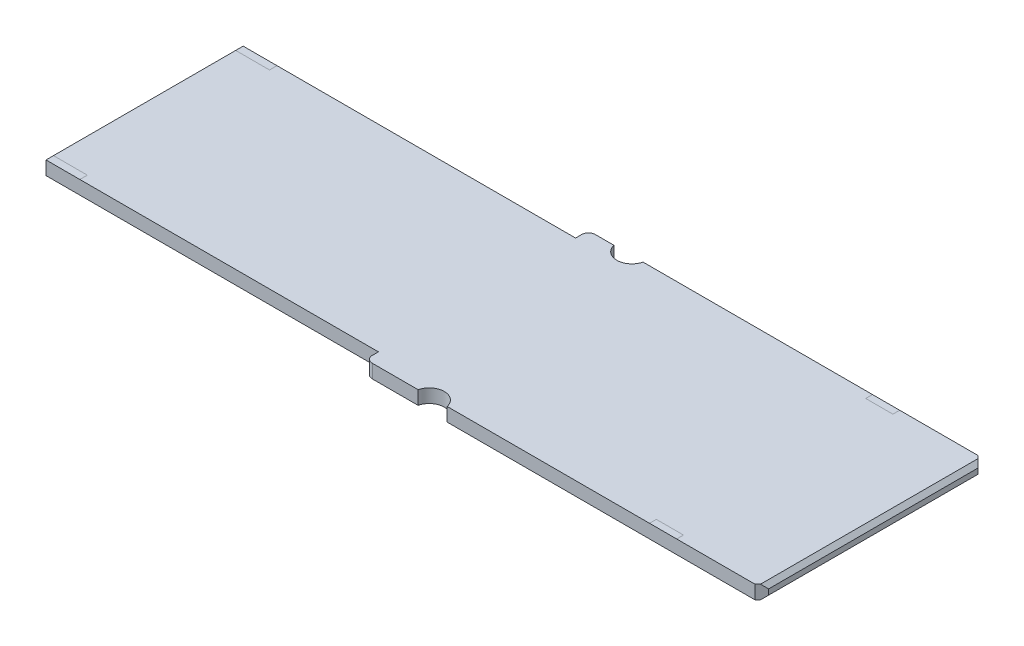
from build123d import *

# Parameters (mm, degrees)
BOSS_EXTRUDE1_DEPTH = 0.5
CHAMFER3_SIZE       = 0.5
SKETCH2_R           = 1.1
CUT_EXTRUDE1_DEPTH  = 55.232831385
FILLET1_R           = 0.5
SKETCH8_W           = 2.49
SKETCH8_H           = 0.55
SKETCH8_W_2         = 2
SKETCH8_H_2         = 0.5
CUT_EXTRUDE3_DEPTH  = 0.0001
SKETCH9_W           = 2
SKETCH9_H           = 16.4
CUT_EXTRUDE4_DEPTH  = 0.0001
CHAMFER4_SIZE       = 0.3


with BuildPart() as part:
    # Sketch1 → Boss-Extrude1 (new, symmetric)
    with BuildSketch(Plane(origin=(0, 0, 0), x_dir=(1, 0, 0), z_dir=(0, 1, 0))):
        Polygon((0, 7.25), (0, -7.25), (24.45, -7.25), (24.45, -8.2), (53.6, -8.2), (53.6, 8.2), (24.45, 8.2), (24.45, 7.25), align=None)
    extrude(amount=BOSS_EXTRUDE1_DEPTH, both=True)

    # Chamfer3
    chamfer3_edges = [part.edges().sort_by_distance(p)[0] for p in [
        (53.6, 0, -8.2),
        (53.6, 0, 8.2),
    ]]
    chamfer(chamfer3_edges, length=CHAMFER3_SIZE)

    # Sketch2 → Cut-Extrude1 (cut, through all)
    with BuildSketch(Plane.XZ.offset(0.5)):
        with Locations((29.39, 8.45)):
            Circle(SKETCH2_R)
        with Locations((27.39, -8.45)):
            Circle(SKETCH2_R)
    extrude(amount=-CUT_EXTRUDE1_DEPTH, mode=Mode.SUBTRACT)

    # Fillet1
    fillet1_edges = [part.edges().sort_by_distance(p)[0] for p in [
        (24.45, 0, -8.2),
        (24.45, 0, 8.2),
    ]]
    fillet(fillet1_edges, radius=FILLET1_R)

    # Sketch8 → Cut-Extrude3 (cut)
    with BuildSketch(Plane(origin=(0, 0.5, 0), x_dir=(1, 0, 0), z_dir=(0, 1, 0))):
        with Locations((1.245, -6.975)):
            Rectangle(SKETCH8_W, SKETCH8_H)
        with Locations((1.245, 6.975)):
            Rectangle(SKETCH8_W, SKETCH8_H)
        with Locations((46.34, -7.95)):
            Rectangle(SKETCH8_W_2, SKETCH8_H_2)
        with Locations((46.34, 7.95)):
            Rectangle(SKETCH8_W_2, SKETCH8_H_2)
    extrude(amount=-CUT_EXTRUDE3_DEPTH, mode=Mode.SUBTRACT)

    # Sketch9 → Cut-Extrude4 (cut)
    with BuildSketch(Plane.XZ.offset(0.5)):
        with BuildLine():
            Line((2.09, 7.425), (0.49, 7.425))
            ThreePointArc((0.49, 7.425), (0.313223305, 7.351776695), (0.24, 7.175))
            Line((0.24, 7.175), (0.24, 6.925))
            ThreePointArc((0.24, 6.925), (0.313223305, 6.748223305), (0.49, 6.675))
            Line((0.49, 6.675), (2.09, 6.675))
            ThreePointArc((2.09, 6.675), (2.266776695, 6.748223305), (2.34, 6.925))
            Line((2.34, 6.925), (2.34, 7.175))
            ThreePointArc((2.34, 7.175), (2.266776695, 7.351776695), (2.09, 7.425))
        make_face()
        with BuildLine():
            Line((2.34, -7.175), (2.34, -6.925))
            ThreePointArc((2.34, -6.925), (2.266776695, -6.748223305), (2.09, -6.675))
            Line((2.09, -6.675), (0.49, -6.675))
            ThreePointArc((0.49, -6.675), (0.313223305, -6.748223305), (0.24, -6.925))
            Line((0.24, -6.925), (0.24, -7.175))
            ThreePointArc((0.24, -7.175), (0.313223305, -7.351776695), (0.49, -7.425))
            Line((0.49, -7.425), (2.09, -7.425))
            ThreePointArc((2.09, -7.425), (2.266776695, -7.351776695), (2.34, -7.175))
        make_face()
        with BuildLine():
            Line((26.14, -8.125), (26.14, -7.575))
            ThreePointArc((26.14, -7.575), (26.066776695, -7.398223305), (25.89, -7.325))
            Line((25.89, -7.325), (25.11, -7.325))
            ThreePointArc((25.11, -7.325), (24.933223305, -7.398223305), (24.86, -7.575))
            Line((24.86, -7.575), (24.86, -8.125))
            ThreePointArc((24.86, -8.125), (24.933223305, -8.301776695), (25.11, -8.375))
            Line((25.11, -8.375), (25.89, -8.375))
            ThreePointArc((25.89, -8.375), (26.066776695, -8.301776695), (26.14, -8.125))
        make_face()
        with Locations((46.34, 0)):
            Rectangle(SKETCH9_W, SKETCH9_H)
        with BuildLine():
            Line((25.49, 7.325), (26.89, 7.325))
            ThreePointArc((26.89, 7.325), (27.066776695, 7.398223305), (27.14, 7.575))
            Line((27.14, 7.575), (27.14, 8.125))
            ThreePointArc((27.14, 8.125), (27.066776695, 8.301776695), (26.89, 8.375))
            Line((26.89, 8.375), (25.49, 8.375))
            ThreePointArc((25.49, 8.375), (25.313223305, 8.301776695), (25.24, 8.125))
            Line((25.24, 8.125), (25.24, 7.575))
            ThreePointArc((25.24, 7.575), (25.313223305, 7.398223305), (25.49, 7.325))
        make_face()
    extrude(amount=-CUT_EXTRUDE4_DEPTH, mode=Mode.SUBTRACT)

    # Chamfer4
    chamfer4_edges = [part.edges().sort_by_distance(p)[0] for p in [
        (53.6, -0.5, 0),
        (53.6, 0.5, 0),
    ]]
    chamfer(chamfer4_edges, length=CHAMFER4_SIZE)


solid = part.part
